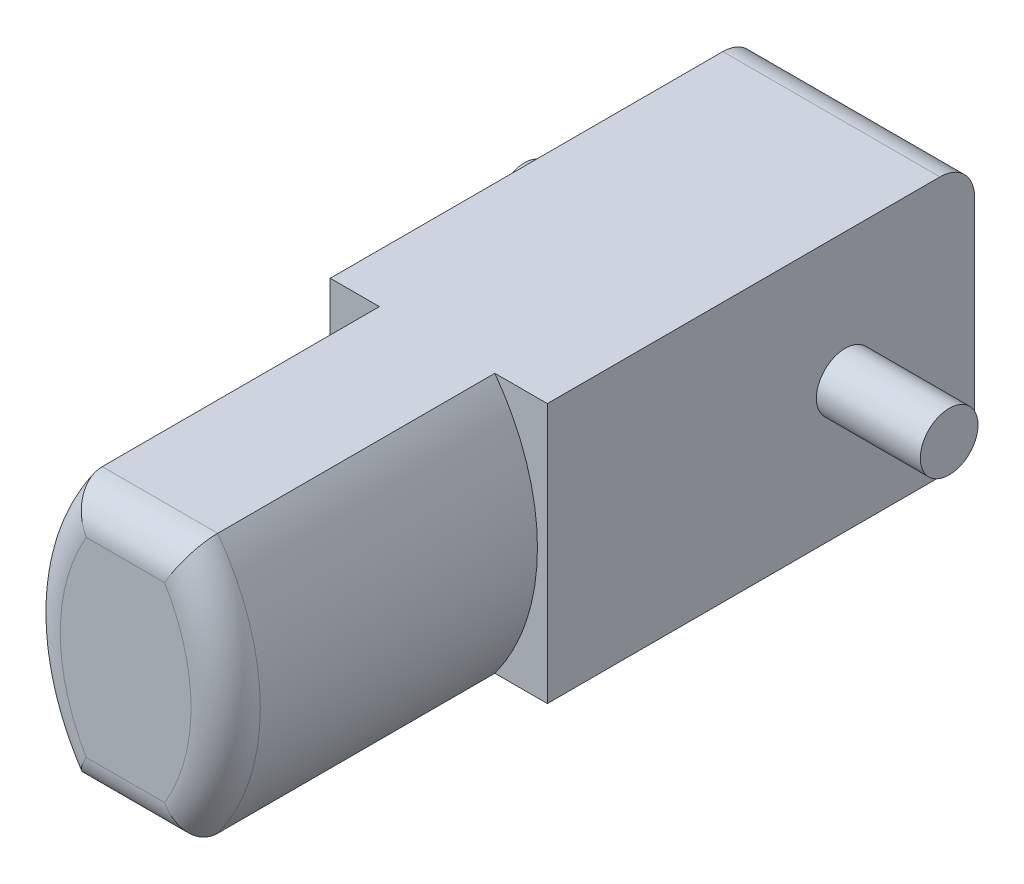
from build123d import *

# Parameters (mm, degrees)
SKETCH_1_W           = 18.8
SKETCH_1_H           = 22.5
EXTRUDE_1_DEPTH      = 37
FILLET_1_R           = 3
SKETCH_2_W           = 5
SKETCH_2_H           = 22.5
EXTRUDE_2_DEPTH      = 27
FILLET_2_R           = 3
EXTRUDE_3_DEPTH      = 9
EXTRUDE_3_DEPTH_BACK = 27.8
SKETCH_3_R           = 2.5


with BuildPart() as part:
    # 草图1 → 凸台-拉伸1 (new body)
    with BuildSketch(Plane.XY):
        with Locations((9.4, 11.25)):
            Rectangle(SKETCH_1_W, SKETCH_1_H)
    extrude(amount=EXTRUDE_1_DEPTH)

    # 圆角1
    fillet_1_edges = [part.edges().sort_by_distance(p)[0] for p in [
        (9.4, 0, 0),
        (9.4, 22.5, 0),
    ]]
    fillet(fillet_1_edges, radius=FILLET_1_R)

    # 草图2 → 凸台-拉伸2 (add)
    with BuildSketch(Plane.XY.offset(37)):
        with Locations((6.75562561, 11.25)):
            Rectangle(SKETCH_2_W, SKETCH_2_H)
        with Locations((11.75562561, 11.25)):
            Rectangle(SKETCH_2_W, SKETCH_2_H)
        with BuildLine():
            Line((14.25562561, 22.5), (14.25562561, 0))
            ThreePointArc((14.25562561, 0), (17.943444104, 11.25), (14.25562561, 22.5))
        make_face()
        with BuildLine():
            Line((4.25562561, 22.5), (4.25562561, 0))
            ThreePointArc((4.25562561, 0), (0.624004306, 11.25), (4.25562561, 22.5))
        make_face()
    extrude(amount=EXTRUDE_2_DEPTH)

    # 圆角2
    fillet_2_edges = [part.edges().sort_by_distance(p)[0] for p in [
        (9.25562561, 0, 64),
        (17.943444104, 11.25, 64),
        (9.25562561, 22.5, 64),
        (0.624004306, 11.25, 64),
    ]]
    fillet(fillet_2_edges, radius=FILLET_2_R)

    # 草图3 → 凸台-拉伸3 (add, two sides: drawn at the far end of the back side and taken through both)
    with BuildSketch(Plane.ZY.offset(-EXTRUDE_3_DEPTH_BACK)):
        with Locations((11.2, 11.25)):
            Circle(SKETCH_3_R)
    extrude(amount=EXTRUDE_3_DEPTH + EXTRUDE_3_DEPTH_BACK)


solid = part.part
